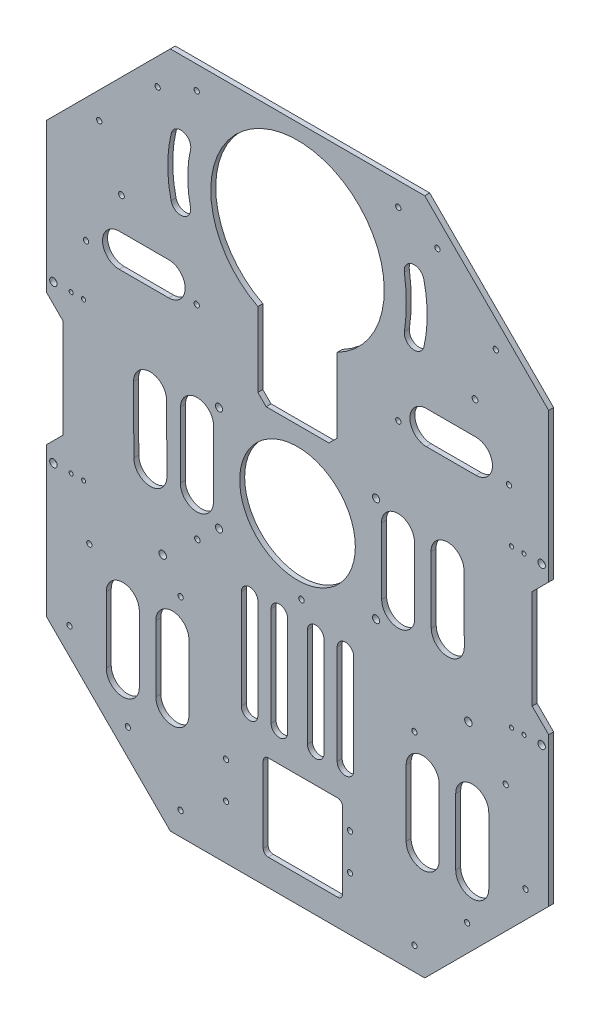
from build123d import *

# Parameters (mm, degrees)
EXTRUDE_1_DEPTH      = 3
CUT_EXTRUDE_1_REACH  = 251.56
SKETCH_2_R           = 2.25
CUT_EXTRUDE_2_REACH  = 251.56
SKETCH_3_R           = 1.25
EXTRUDE_2_DEPTH      = 3
CUT_EXTRUDE_4_REACH  = 292.73
SKETCH_7_R           = 2.1
FILLET_1_R           = 5
SKETCH_17_R          = 1.75
CUT_EXTRUDE_13_DEPTH = 10
CUT_EXTRUDE_15_REACH = 292.73
SKETCH_20_R          = 2.25
SKETCH_20_R_2        = 1.65
SKETCH_20_R_3        = 1.8
SKETCH1_R            = 35
CUT_EXTRUDE1_DEPTH   = 10
SKETCH2_W            = 304
SKETCH2_H            = 131.698870116
EXTRUDE1_DEPTH       = 3
CUT_EXTRUDE2_DEPTH   = 10
CUT_EXTRUDE3_DEPTH   = 3
SKETCH6_R            = 1.6
CUT_EXTRUDE4_DEPTH   = 5
SKETCH7_R            = 1.6
CUT_EXTRUDE5_DEPTH   = 5
CUT_EXTRUDE6_DEPTH   = 5
CUT_EXTRUDE7_DEPTH   = 10
SKETCH10_R           = 2.15
CUT_EXTRUDE8_DEPTH   = 10


with BuildPart() as part:
    # 草图1 → 凸台-拉伸1 (new body)
    with BuildSketch(Plane.XY):
        Polygon((-125.824947589, 164.713768905), (-125.824947589, 174.713768905), (-115.824947589, 174.713768905), (168.675052411, 174.713768905), (178.175052411, 174.713768905), (178.175052411, 164.713768905), (178.175052411, -65.286231095), (178.175052411, -75.286231095), (168.175052411, -75.286231095), (-116.324947589, -75.286231095), (-125.824947589, -75.286231095), (-125.824947589, -65.286231095), align=None)
    extrude(amount=EXTRUDE_1_DEPTH)

    # 草图2 → 切除-拉伸1 (cut, up to next)
    with BuildSketch(Plane.XY.offset(3), mode=Mode.PRIVATE) as cut_extrude_1_sk1:
        with Locations((173.925052411, 93.630496984)):
            Circle(SKETCH_2_R)
    cut_extrude_1_tool1 = extrude(cut_extrude_1_sk1.sketch, amount=-CUT_EXTRUDE_1_REACH, mode=Mode.PRIVATE) & part.part
    # 草图2 → 切除-拉伸1 (cut, up to next)
    with BuildSketch(Plane.XY.offset(3), mode=Mode.PRIVATE) as cut_extrude_1_sk2:
        with Locations((173.925052411, -1.369503016)):
            Circle(SKETCH_2_R)
    cut_extrude_1_tool2 = extrude(cut_extrude_1_sk2.sketch, amount=-CUT_EXTRUDE_1_REACH, mode=Mode.PRIVATE) & part.part
    # 草图2 → 切除-拉伸1 (cut, up to next)
    with BuildSketch(Plane.XY.offset(3), mode=Mode.PRIVATE) as cut_extrude_1_sk3:
        with Locations((-121.574947589, 93.630496984)):
            Circle(SKETCH_2_R)
    cut_extrude_1_tool3 = extrude(cut_extrude_1_sk3.sketch, amount=-CUT_EXTRUDE_1_REACH, mode=Mode.PRIVATE) & part.part
    # 草图2 → 切除-拉伸1 (cut, up to next)
    with BuildSketch(Plane.XY.offset(3), mode=Mode.PRIVATE) as cut_extrude_1_sk4:
        with Locations((-121.574947589, -1.369503016)):
            Circle(SKETCH_2_R)
    cut_extrude_1_tool4 = extrude(cut_extrude_1_sk4.sketch, amount=-CUT_EXTRUDE_1_REACH, mode=Mode.PRIVATE) & part.part
    add(cut_extrude_1_tool1.solids().sort_by_distance((173.925052, 93.630497, 3))[0], mode=Mode.SUBTRACT)
    add(cut_extrude_1_tool2.solids().sort_by_distance((173.925052, -1.369503, 3))[0], mode=Mode.SUBTRACT)
    add(cut_extrude_1_tool3.solids().sort_by_distance((-121.574948, 93.630497, 3))[0], mode=Mode.SUBTRACT)
    add(cut_extrude_1_tool4.solids().sort_by_distance((-121.574948, -1.369503, 3))[0], mode=Mode.SUBTRACT)

    # 草图3 → 切除-拉伸2 (cut, up to next)
    with BuildSketch(Plane.XY.offset(3), mode=Mode.PRIVATE) as cut_extrude_2_sk1:
        with Locations((155.675052411, 93.630496984)):
            Circle(SKETCH_3_R)
    cut_extrude_2_tool1 = extrude(cut_extrude_2_sk1.sketch, amount=-CUT_EXTRUDE_2_REACH, mode=Mode.PRIVATE) & part.part
    # 草图3 → 切除-拉伸2 (cut, up to next)
    with BuildSketch(Plane.XY.offset(3), mode=Mode.PRIVATE) as cut_extrude_2_sk2:
        with Locations((163.175052411, 93.630496984)):
            Circle(SKETCH_3_R)
    cut_extrude_2_tool2 = extrude(cut_extrude_2_sk2.sketch, amount=-CUT_EXTRUDE_2_REACH, mode=Mode.PRIVATE) & part.part
    # 草图3 → 切除-拉伸2 (cut, up to next)
    with BuildSketch(Plane.XY.offset(3), mode=Mode.PRIVATE) as cut_extrude_2_sk3:
        with Locations((163.175052411, -1.369503016)):
            Circle(SKETCH_3_R)
    cut_extrude_2_tool3 = extrude(cut_extrude_2_sk3.sketch, amount=-CUT_EXTRUDE_2_REACH, mode=Mode.PRIVATE) & part.part
    # 草图3 → 切除-拉伸2 (cut, up to next)
    with BuildSketch(Plane.XY.offset(3), mode=Mode.PRIVATE) as cut_extrude_2_sk4:
        with Locations((155.675052411, -1.369503016)):
            Circle(SKETCH_3_R)
    cut_extrude_2_tool4 = extrude(cut_extrude_2_sk4.sketch, amount=-CUT_EXTRUDE_2_REACH, mode=Mode.PRIVATE) & part.part
    # 草图3 → 切除-拉伸2 (cut, up to next)
    with BuildSketch(Plane.XY.offset(3), mode=Mode.PRIVATE) as cut_extrude_2_sk5:
        with Locations((-103.324947589, 93.630496984)):
            Circle(SKETCH_3_R)
    cut_extrude_2_tool5 = extrude(cut_extrude_2_sk5.sketch, amount=-CUT_EXTRUDE_2_REACH, mode=Mode.PRIVATE) & part.part
    # 草图3 → 切除-拉伸2 (cut, up to next)
    with BuildSketch(Plane.XY.offset(3), mode=Mode.PRIVATE) as cut_extrude_2_sk6:
        with Locations((-110.824947589, 93.630496984)):
            Circle(SKETCH_3_R)
    cut_extrude_2_tool6 = extrude(cut_extrude_2_sk6.sketch, amount=-CUT_EXTRUDE_2_REACH, mode=Mode.PRIVATE) & part.part
    # 草图3 → 切除-拉伸2 (cut, up to next)
    with BuildSketch(Plane.XY.offset(3), mode=Mode.PRIVATE) as cut_extrude_2_sk7:
        with Locations((-103.324947589, -1.369503016)):
            Circle(SKETCH_3_R)
    cut_extrude_2_tool7 = extrude(cut_extrude_2_sk7.sketch, amount=-CUT_EXTRUDE_2_REACH, mode=Mode.PRIVATE) & part.part
    # 草图3 → 切除-拉伸2 (cut, up to next)
    with BuildSketch(Plane.XY.offset(3), mode=Mode.PRIVATE) as cut_extrude_2_sk8:
        with Locations((-110.824947589, -1.369503016)):
            Circle(SKETCH_3_R)
    cut_extrude_2_tool8 = extrude(cut_extrude_2_sk8.sketch, amount=-CUT_EXTRUDE_2_REACH, mode=Mode.PRIVATE) & part.part
    add(cut_extrude_2_tool1.solids().sort_by_distance((155.675052, 93.630497, 3))[0], mode=Mode.SUBTRACT)
    add(cut_extrude_2_tool2.solids().sort_by_distance((163.175052, 93.630497, 3))[0], mode=Mode.SUBTRACT)
    add(cut_extrude_2_tool3.solids().sort_by_distance((163.175052, -1.369503, 3))[0], mode=Mode.SUBTRACT)
    add(cut_extrude_2_tool4.solids().sort_by_distance((155.675052, -1.369503, 3))[0], mode=Mode.SUBTRACT)
    add(cut_extrude_2_tool5.solids().sort_by_distance((-103.324948, 93.630497, 3))[0], mode=Mode.SUBTRACT)
    add(cut_extrude_2_tool6.solids().sort_by_distance((-110.824948, 93.630497, 3))[0], mode=Mode.SUBTRACT)
    add(cut_extrude_2_tool7.solids().sort_by_distance((-103.324948, -1.369503, 3))[0], mode=Mode.SUBTRACT)
    add(cut_extrude_2_tool8.solids().sort_by_distance((-110.824948, -1.369503, 3))[0], mode=Mode.SUBTRACT)

    # 草图6 → 凸台-拉伸2 (add)
    with BuildSketch(Plane.XY.offset(3)):
        Polygon((-120.824947589, -105.286231095), (173.675052411, -105.286231095), (178.175052411, -105.286231095), (178.175052411, -100.286231095), (178.175052411, -75.286231095), (-125.824947589, -75.286231095), (-125.824947589, -100.286231095), (-125.824947589, -105.286231095), align=None)
        Polygon((178.175052411, 174.713768905), (178.175052411, 199.713768905), (178.175052411, 229.713768905), (173.675052411, 229.713768905), (-120.824947589, 229.713768905), (-125.824947589, 229.713768905), (-125.824947589, 199.713768905), (-125.824947589, 174.713768905), align=None)
    extrude(amount=-EXTRUDE_2_DEPTH)

    # 草图7 → 切除-拉伸4 (cut, up to next)
    with BuildSketch(Plane.XY.offset(3), mode=Mode.PRIVATE) as cut_extrude_4_sk1:
        with Locations((-112.074947589, 219.713768905)):
            Circle(SKETCH_7_R)
    cut_extrude_4_tool1 = extrude(cut_extrude_4_sk1.sketch, amount=-CUT_EXTRUDE_4_REACH, mode=Mode.PRIVATE) & part.part
    # 草图7 → 切除-拉伸4 (cut, up to next)
    with BuildSketch(Plane.XY.offset(3), mode=Mode.PRIVATE) as cut_extrude_4_sk2:
        with Locations((-112.074947589, -95.286231095)):
            Circle(SKETCH_7_R)
    cut_extrude_4_tool2 = extrude(cut_extrude_4_sk2.sketch, amount=-CUT_EXTRUDE_4_REACH, mode=Mode.PRIVATE) & part.part
    cut_extrude_4_1 = cut_extrude_4_tool1.solids().sort_by_distance((-112.074948, 219.713769, 3))[0]
    add(cut_extrude_4_1, mode=Mode.SUBTRACT)
    cut_extrude_4_2 = cut_extrude_4_tool2.solids().sort_by_distance((-112.074948, -95.286231, 3))[0]
    add(cut_extrude_4_2, mode=Mode.SUBTRACT)
    cut_extrude_4 = cut_extrude_4_1 + cut_extrude_4_2  # 切除-拉伸4 as one shape, for the pattern or mirror that repeats it

    # 镜向3: 切除-拉伸4 across plane
    add(cut_extrude_4.mirror(Plane.ZY.offset(-26.425052411)), mode=Mode.SUBTRACT)

    # 圆角1
    fillet_1_edges = [part.edges().sort_by_distance(p)[0] for p in [
        (178.175052411, -105.286231095, 1.5),
        (-125.824947589, -105.286231095, 1.5),
        (-125.824947589, 229.713768905, 1.5),
        (178.175052411, 229.713768905, 1.5),
    ]]
    fillet(fillet_1_edges, radius=FILLET_1_R)

    # 草图17 → 切除-拉伸13 (cut)
    with BuildSketch(Plane.XY.offset(3)):
        with Locations((-80.389287535, 159.713768905)):
            Circle(SKETCH_17_R)
        with Locations((133.610710686, 159.713768905)):
            Circle(SKETCH_17_R)
    extrude(amount=-CUT_EXTRUDE_13_DEPTH, mode=Mode.SUBTRACT)

    # 草图20 → 切除-拉伸15 (cut, up to next)
    with BuildSketch(Plane.XY.offset(3), mode=Mode.PRIVATE) as cut_extrude_15_sk1:
        with Locations((-55.442932906, -16.286231095)):
            Circle(SKETCH_20_R)
    cut_extrude_15_tool1 = extrude(cut_extrude_15_sk1.sketch, amount=-CUT_EXTRUDE_15_REACH, mode=Mode.PRIVATE) & part.part
    # 草图20 → 切除-拉伸15 (cut, up to next)
    with BuildSketch(Plane.XY.offset(3), mode=Mode.PRIVATE) as cut_extrude_15_sk2:
        with Locations((-34.442932906, 2.213768905)):
            Circle(SKETCH_20_R_2)
    cut_extrude_15_tool2 = extrude(cut_extrude_15_sk2.sketch, amount=-CUT_EXTRUDE_15_REACH, mode=Mode.PRIVATE) & part.part
    # 草图20 → 切除-拉伸15 (cut, up to next)
    with BuildSketch(Plane.XY.offset(3), mode=Mode.PRIVATE) as cut_extrude_15_sk3:
        with Locations((28.557067094, 2.213768905)):
            Circle(SKETCH_20_R_2)
    cut_extrude_15_tool3 = extrude(cut_extrude_15_sk3.sketch, amount=-CUT_EXTRUDE_15_REACH, mode=Mode.PRIVATE) & part.part
    # 草图20 → 切除-拉伸15 (cut, up to next)
    with BuildSketch(Plane.XY.offset(3), mode=Mode.PRIVATE) as cut_extrude_15_sk4:
        with Locations((129.557067094, -11.286231095)):
            Circle(SKETCH_20_R)
    cut_extrude_15_tool4 = extrude(cut_extrude_15_sk4.sketch, amount=-CUT_EXTRUDE_15_REACH, mode=Mode.PRIVATE) & part.part
    # 草图20 → 切除-拉伸15 (cut, up to next)
    with BuildSketch(Plane.XY.offset(3), mode=Mode.PRIVATE) as cut_extrude_15_sk5:
        with Locations((28.557067094, -39.786231095)):
            Circle(SKETCH_20_R_2)
    cut_extrude_15_tool5 = extrude(cut_extrude_15_sk5.sketch, amount=-CUT_EXTRUDE_15_REACH, mode=Mode.PRIVATE) & part.part
    # 草图20 → 切除-拉伸15 (cut, up to next)
    with BuildSketch(Plane.XY.offset(3), mode=Mode.PRIVATE) as cut_extrude_15_sk6:
        with Locations((-34.442932906, -39.786231095)):
            Circle(SKETCH_20_R_2)
    cut_extrude_15_tool6 = extrude(cut_extrude_15_sk6.sketch, amount=-CUT_EXTRUDE_15_REACH, mode=Mode.PRIVATE) & part.part
    # 草图20 → 切除-拉伸15 (cut, up to next)
    with BuildSketch(Plane.XY.offset(3), mode=Mode.PRIVATE) as cut_extrude_15_sk7:
        with Locations((39.557067094, -79.286231095)):
            Circle(SKETCH_20_R)
    cut_extrude_15_tool7 = extrude(cut_extrude_15_sk7.sketch, amount=-CUT_EXTRUDE_15_REACH, mode=Mode.PRIVATE) & part.part
    # 草图20 → 切除-拉伸15 (cut, up to next)
    with BuildSketch(Plane.XY.offset(3), mode=Mode.PRIVATE) as cut_extrude_15_sk8:
        with Locations((6.950002885, -78.768485292)):
            Circle(SKETCH_20_R_3)
    cut_extrude_15_tool8 = extrude(cut_extrude_15_sk8.sketch, amount=-CUT_EXTRUDE_15_REACH, mode=Mode.PRIVATE) & part.part
    # 草图20 → 切除-拉伸15 (cut, up to next)
    with BuildSketch(Plane.XY.offset(3), mode=Mode.PRIVATE) as cut_extrude_15_sk9:
        with Locations((-55.442932906, -79.286231095)):
            Circle(SKETCH_20_R_3)
    cut_extrude_15_tool9 = extrude(cut_extrude_15_sk9.sketch, amount=-CUT_EXTRUDE_15_REACH, mode=Mode.PRIVATE) & part.part
    # 草图20 → 切除-拉伸15 (cut, up to next)
    with BuildSketch(Plane.XY.offset(3), mode=Mode.PRIVATE) as cut_extrude_15_sk10:
        with Locations((-25.049997115, -78.768485292)):
            Circle(SKETCH_20_R_3)
    cut_extrude_15_tool10 = extrude(cut_extrude_15_sk10.sketch, amount=-CUT_EXTRUDE_15_REACH, mode=Mode.PRIVATE) & part.part
    add(cut_extrude_15_tool1.solids().sort_by_distance((-55.442933, -16.286231, 3))[0], mode=Mode.SUBTRACT)
    add(cut_extrude_15_tool2.solids().sort_by_distance((-34.442933, 2.213769, 3))[0], mode=Mode.SUBTRACT)
    add(cut_extrude_15_tool3.solids().sort_by_distance((28.557067, 2.213769, 3))[0], mode=Mode.SUBTRACT)
    add(cut_extrude_15_tool4.solids().sort_by_distance((129.557067, -11.286231, 3))[0], mode=Mode.SUBTRACT)
    add(cut_extrude_15_tool5.solids().sort_by_distance((28.557067, -39.786231, 3))[0], mode=Mode.SUBTRACT)
    add(cut_extrude_15_tool6.solids().sort_by_distance((-34.442933, -39.786231, 3))[0], mode=Mode.SUBTRACT)
    add(cut_extrude_15_tool7.solids().sort_by_distance((39.557067, -79.286231, 3))[0], mode=Mode.SUBTRACT)
    add(cut_extrude_15_tool8.solids().sort_by_distance((6.950003, -78.768485, 3))[0], mode=Mode.SUBTRACT)
    add(cut_extrude_15_tool9.solids().sort_by_distance((-55.442933, -79.286231, 3))[0], mode=Mode.SUBTRACT)
    add(cut_extrude_15_tool10.solids().sort_by_distance((-25.049997, -78.768485, 3))[0], mode=Mode.SUBTRACT)

    # Sketch1 → Cut-Extrude1 (cut)
    with BuildSketch(Plane.XY.offset(3)):
        with Locations((26.175052411, 46.130496984)):
            Circle(SKETCH1_R)
        with BuildLine():
            Line((2.175052411, 142.570469656), (2.175052411, 97.570469656))
            Line((2.175052411, 97.570469656), (7.175052411, 92.570469656))
            Line((7.175052411, 92.570469656), (45.175052411, 92.570469656))
            Line((45.175052411, 92.570469656), (50.175052411, 97.570469656))
            Line((50.175052411, 97.570469656), (50.175052411, 142.570469656))
            ThreePointArc((50.175052411, 142.570469656), (26.175052411, 241.763616905), (2.175052411, 142.570469656))
        make_face()
    extrude(amount=-CUT_EXTRUDE1_DEPTH, mode=Mode.SUBTRACT)

    # Sketch2 → Extrude1 (add)
    with BuildSketch(Plane.XY.offset(3)):
        with BuildLine():
            Line((-125.824947589, 207.236940942), (-23.152522261, 207.236940942))
            ThreePointArc((-23.152522261, 207.236940942), (26.175052411, 241.763616905), (75.502627083, 207.236940942))
            Line((75.502627083, 207.236940942), (178.175052411, 207.236940942))
            Line((178.175052411, 207.236940942), (178.175052411, 251.130496984))
            Line((178.175052411, 251.130496984), (-125.824947589, 251.130496984))
            Line((-125.824947589, 251.130496984), (-125.824947589, 207.236940942))
        make_face()
        with Locations((26.175052411, -93.020067958)):
            Rectangle(SKETCH2_W, SKETCH2_H)
    extrude(amount=-EXTRUDE1_DEPTH)

    # Sketch3 → Cut-Extrude2 (cut)
    with BuildSketch(Plane.XY.offset(3)):
        Polygon((-125.824947589, 176.130496984), (-50.824947589, 251.130496984), (103.175052411, 251.130496984), (178.175052411, 176.130496984), (178.175052411, 299.602664111), (-125.824947589, 299.602664111), align=None)
        Polygon((-125.824947589, -83.869503016), (-50.824947589, -158.869503016), (103.175052411, -158.869503016), (178.175052411, -83.869503016), (178.175052411, -212.471230051), (-125.824947589, -212.471230051), align=None)
    extrude(amount=-CUT_EXTRUDE2_DEPTH, mode=Mode.SUBTRACT)

    # Sketch5 → Cut-Extrude3 (cut)
    with BuildSketch(Plane(origin=(0, 0, 0), x_dir=(-1, 0, 0), z_dir=(0, 0, -1))):
        with BuildLine():
            Line((59.574947589, -52.869503016), (59.574947589, -92.869503016))
            ThreePointArc((59.574947589, -92.869503016), (49.574947589, -102.869503016), (39.574947589, -92.869503016))
            Line((39.574947589, -92.869503016), (39.574947589, -52.869503016))
            ThreePointArc((39.574947589, -52.869503016), (49.574947589, -42.869503016), (59.574947589, -52.869503016))
        make_face()
        with BuildLine():
            Line((-111.925052411, -52.869503016), (-111.925052411, -92.869503016))
            ThreePointArc((-111.925052411, -92.869503016), (-101.925052411, -102.869503016), (-91.925052411, -92.869503016))
            Line((-91.925052411, -92.869503016), (-91.925052411, -52.869503016))
            ThreePointArc((-91.925052411, -52.869503016), (-101.925052411, -42.869503016), (-111.925052411, -52.869503016))
        make_face()
        with BuildLine():
            Line((51.824947589, 120.122246406), (81.824947589, 120.122246406))
            ThreePointArc((81.824947589, 120.122246406), (91.824947589, 130.122246406), (81.824947589, 140.122246406))
            Line((81.824947589, 140.122246406), (51.824947589, 140.122246406))
            ThreePointArc((51.824947589, 140.122246406), (41.824947589, 130.122246406), (51.824947589, 120.122246406))
        make_face()
        with BuildLine():
            Line((-104.164051641, 120.122246406), (-134.164051641, 120.122246406))
            ThreePointArc((-134.164051641, 120.122246406), (-144.164051641, 130.122246406), (-134.164051641, 140.122246406))
            Line((-134.164051641, 140.122246406), (-104.164051641, 140.122246406))
            ThreePointArc((-104.164051641, 140.122246406), (-94.164051641, 130.122246406), (-104.164051641, 120.122246406))
        make_face()
        with BuildLine():
            ThreePointArc((-90.835977614, 204.898691347), (-91.984904794, 189.404607088), (-90.900880542, 173.905846746))
            ThreePointArc((-90.900880542, 173.905846746), (-95.74520642, 167.159036995), (-102.688831807, 171.716777829))
            ThreePointArc((-102.688831807, 171.716777829), (-104.675609059, 189.431183024), (-102.614657158, 207.137111764))
            ThreePointArc((-102.614657158, 207.137111764), (-95.652003785, 211.665731094), (-90.835977614, 204.898691347))
        make_face()
        with BuildLine():
            ThreePointArc((38.642404158, 174.39931995), (43.157326011, 167.244306214), (50.338787298, 171.7170408))
            ThreePointArc((50.338787298, 171.7170408), (52.377578145, 189.428116028), (50.264627051, 207.130496984))
            ThreePointArc((50.264627051, 207.130496984), (43.064495891, 211.573114701), (38.579580509, 204.39925417))
            ThreePointArc((38.579580509, 204.39925417), (40.280100911, 189.402782384), (38.642404158, 174.39931995))
        make_face()
    extrude(amount=-CUT_EXTRUDE3_DEPTH, mode=Mode.SUBTRACT)

    # Sketch6 → Cut-Extrude4 (cut)
    with BuildSketch(Plane(origin=(0, 0, 0), x_dir=(-1, 0, 0), z_dir=(0, 0, -1))):
        with Locations((-87.175052411, 125.130496984)):
            Circle(SKETCH6_R)
        with Locations((-154.175052411, 125.130496984)):
            Circle(SKETCH6_R)
        with Locations((-146.175052411, 191.996586745)):
            Circle(SKETCH6_R)
        with Locations((-110.819713352, 227.351925804)):
            Circle(SKETCH6_R)
        with Locations((-87.175052411, 237.130496984)):
            Circle(SKETCH6_R)
        with Locations((101.824947589, 125.130496984)):
            Circle(SKETCH6_R)
        with Locations((34.824947589, 125.130496984)):
            Circle(SKETCH6_R)
        with Locations((93.824947589, 191.996586745)):
            Circle(SKETCH6_R)
        with Locations((58.46960853, 227.351925804)):
            Circle(SKETCH6_R)
        with Locations((34.824947589, 237.130496984)):
            Circle(SKETCH6_R)
        with Locations((99.824947589, -32.869503016)):
            Circle(SKETCH6_R)
        with Locations((44.574947589, -32.869503016)):
            Circle(SKETCH6_R)
        with Locations((111.824947589, -81.735592776)):
            Circle(SKETCH6_R)
        with Locations((76.46960853, -117.090931836)):
            Circle(SKETCH6_R)
        with Locations((44.574947589, -144.869503016)):
            Circle(SKETCH6_R)
        with Locations((-96.925052411, -144.869503016)):
            Circle(SKETCH6_R)
        with Locations((-128.819713352, -117.090931836)):
            Circle(SKETCH6_R)
        with Locations((-164.175052411, -81.735592776)):
            Circle(SKETCH6_R)
        with Locations((-96.925052411, -32.869503016)):
            Circle(SKETCH6_R)
        with Locations((-152.175052411, -32.869503016)):
            Circle(SKETCH6_R)
    extrude(amount=-CUT_EXTRUDE4_DEPTH, mode=Mode.SUBTRACT)

    # Sketch7 → Cut-Extrude5 (cut)
    with BuildSketch(Plane(origin=(0, 0, 0), x_dir=(-1, 0, 0), z_dir=(0, 0, -1))):
        with Locations((-57.925052411, -104.369503016)):
            Circle(SKETCH7_R)
        with Locations((-57.925052411, -126.369503016)):
            Circle(SKETCH7_R)
        with Locations((17.074947589, -126.369503016)):
            Circle(SKETCH7_R)
        with Locations((17.074947589, -104.369503016)):
            Circle(SKETCH7_R)
        with BuildLine():
            Line((-50.425052411, -90.869503016), (-8.425052411, -90.869503016))
            ThreePointArc((-8.425052411, -90.869503016), (-6.303732067, -91.748182672), (-5.425052411, -93.869503016))
            Line((-5.425052411, -93.869503016), (-5.425052411, -139.869503016))
            ThreePointArc((-5.425052411, -139.869503016), (-6.303732067, -141.990823359), (-8.425052411, -142.869503016))
            Line((-8.425052411, -142.869503016), (-50.425052411, -142.869503016))
            ThreePointArc((-50.425052411, -142.869503016), (-52.546372754, -141.990823359), (-53.425052411, -139.869503016))
            Line((-53.425052411, -139.869503016), (-53.425052411, -93.869503016))
            ThreePointArc((-53.425052411, -93.869503016), (-52.546372754, -91.748182672), (-50.425052411, -90.869503016))
        make_face()
    extrude(amount=-CUT_EXTRUDE5_DEPTH, mode=Mode.SUBTRACT)

    # Sketch8 → Cut-Extrude6 (cut)
    with BuildSketch(Plane(origin=(0, 0, 0), x_dir=(-1, 0, 0), z_dir=(0, 0, -1))):
        with BuildLine():
            Line((-106.942212254, 66.462032738), (-107.108064487, 26.462376577))
            ThreePointArc((-107.108064487, 26.462376577), (-117.149441586, 16.503925595), (-127.107892568, 26.545302693))
            Line((-127.107892568, 26.545302693), (-126.942040335, 66.544958855))
            ThreePointArc((-126.942040335, 66.544958855), (-116.900663236, 76.503409837), (-106.942212254, 66.462032738))
        make_face()
        with BuildLine():
            Line((53.057959665, 65.798617391), (52.892107432, 25.79896123))
            ThreePointArc((52.892107432, 25.79896123), (62.850558414, 15.757584131), (72.891935513, 25.716035114))
            Line((72.891935513, 25.716035114), (73.057787746, 65.715691275))
            ThreePointArc((73.057787746, 65.715691275), (63.099336764, 75.757068374), (53.057959665, 65.798617391))
        make_face()
    extrude(amount=-CUT_EXTRUDE6_DEPTH, mode=Mode.SUBTRACT)

    # Sketch9 → Cut-Extrude7 (cut)
    with BuildSketch(Plane(origin=(0, 0, 0), x_dir=(-1, 0, 0), z_dir=(0, 0, -1))):
        Polygon((125.824947589, 86.130496984), (115.824947589, 76.130496984), (115.824947589, 16.130496984), (125.824947589, 6.130496984), align=None)
        with BuildLine():
            Line((-60.175052411, -71.869503016), (-60.175052411, -11.869503016))
            ThreePointArc((-60.175052411, -11.869503016), (-55.175052411, -6.869503016), (-50.175052411, -11.869503016))
            Line((-50.175052411, -11.869503016), (-50.175052411, -71.869503016))
            ThreePointArc((-50.175052411, -71.869503016), (-55.175052411, -76.869503016), (-60.175052411, -71.869503016))
        make_face()
        with BuildLine():
            Line((-42.175052411, -71.869503016), (-42.175052411, -11.869503016))
            ThreePointArc((-42.175052411, -11.869503016), (-37.175052411, -6.869503016), (-32.175052411, -11.869503016))
            Line((-32.175052411, -11.869503016), (-32.175052411, -71.869503016))
            ThreePointArc((-32.175052411, -71.869503016), (-37.175052411, -76.869503016), (-42.175052411, -71.869503016))
        make_face()
        with BuildLine():
            Line((7.824947589, -71.869503016), (7.824947589, -11.869503016))
            ThreePointArc((7.824947589, -11.869503016), (2.824947589, -6.869503016), (-2.175052411, -11.869503016))
            Line((-2.175052411, -11.869503016), (-2.175052411, -71.869503016))
            ThreePointArc((-2.175052411, -71.869503016), (2.824947589, -76.869503016), (7.824947589, -71.869503016))
        make_face()
        with BuildLine():
            Line((-10.175052411, -71.869503016), (-10.175052411, -11.869503016))
            ThreePointArc((-10.175052411, -11.869503016), (-15.175052411, -6.869503016), (-20.175052411, -11.869503016))
            Line((-20.175052411, -11.869503016), (-20.175052411, -71.869503016))
            ThreePointArc((-20.175052411, -71.869503016), (-15.175052411, -76.869503016), (-10.175052411, -71.869503016))
        make_face()
        with BuildLine():
            Line((-77.108064487, 26.462376577), (-76.942212254, 66.462032738))
            ThreePointArc((-76.942212254, 66.462032738), (-86.900663236, 76.503409837), (-96.942040335, 66.544958855))
            Line((-96.942040335, 66.544958855), (-97.107892568, 26.545302693))
            ThreePointArc((-97.107892568, 26.545302693), (-87.149441586, 16.503925595), (-77.108064487, 26.462376577))
        make_face()
        with BuildLine():
            Line((44.591935513, 66.544958855), (44.757787746, 26.545302693))
            ThreePointArc((44.757787746, 26.545302693), (34.799336764, 16.503925595), (24.757959665, 26.462376577))
            Line((24.757959665, 26.462376577), (24.592107432, 66.462032738))
            ThreePointArc((24.592107432, 66.462032738), (34.550558414, 76.503409837), (44.591935513, 66.544958855))
        make_face()
        with BuildLine():
            Line((-121.925052411, -92.869503016), (-121.925052411, -52.869503016))
            ThreePointArc((-121.925052411, -52.869503016), (-131.925052411, -42.869503016), (-141.925052411, -52.869503016))
            Line((-141.925052411, -52.869503016), (-141.925052411, -92.869503016))
            ThreePointArc((-141.925052411, -92.869503016), (-131.925052411, -102.869503016), (-121.925052411, -92.869503016))
        make_face()
        with BuildLine():
            Line((89.574947589, -52.869503016), (89.574947589, -92.869503016))
            ThreePointArc((89.574947589, -92.869503016), (79.574947589, -102.869503016), (69.574947589, -92.869503016))
            Line((69.574947589, -92.869503016), (69.574947589, -52.869503016))
            ThreePointArc((69.574947589, -52.869503016), (79.574947589, -42.869503016), (89.574947589, -52.869503016))
        make_face()
        Polygon((-178.175052411, 6.130496984), (-178.175052411, 86.130496984), (-168.175052411, 76.130496984), (-168.175052411, 16.130496984), align=None)
    extrude(amount=-CUT_EXTRUDE7_DEPTH, mode=Mode.SUBTRACT)

    # Sketch10 → Cut-Extrude8 (cut)
    with BuildSketch(Plane(origin=(0, 0, 0), x_dir=(-1, 0, 0), z_dir=(0, 0, -1))):
        with Locations((21.344193174, 14.450999928)):
            Circle(SKETCH10_R)
        with Locations((21.344193174, 77.809994041)):
            Circle(SKETCH10_R)
        with Locations((-73.694297996, 14.450999928)):
            Circle(SKETCH10_R)
        with Locations((-73.694297996, 77.809994041)):
            Circle(SKETCH10_R)
    extrude(amount=-CUT_EXTRUDE8_DEPTH, mode=Mode.SUBTRACT)


solid = part.part
